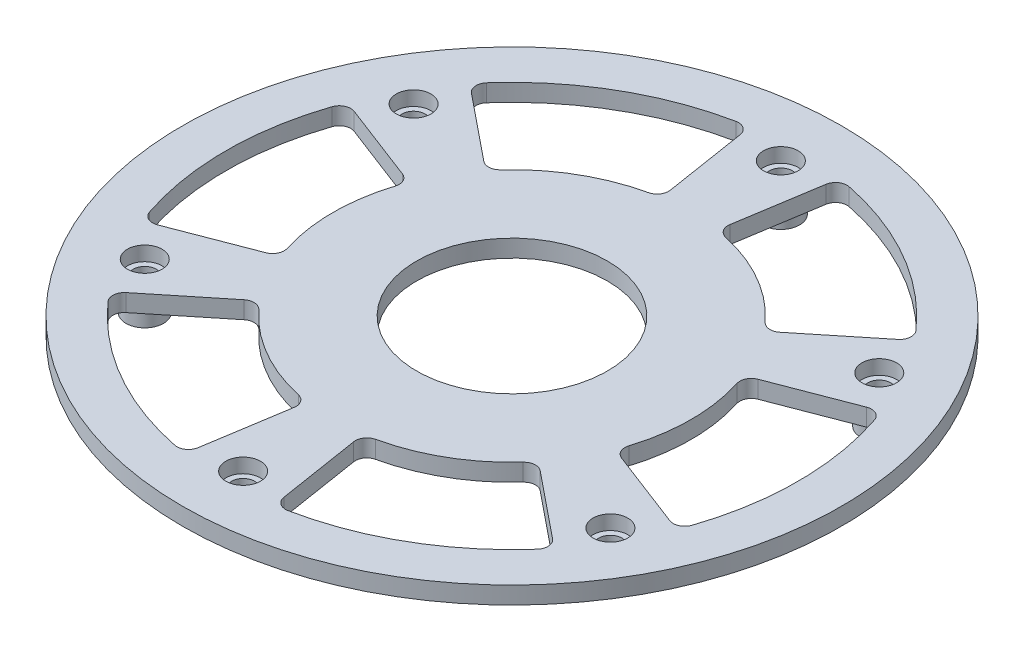
from build123d import *

# Parameters (mm, degrees)
SKETCH1_R                = 57
BOSS_EXTRUDE1_DEPTH      = 3
SKETCH2_R                = 2
CUT_EXTRUDE1_DEPTH       = 81.665977958
CIRPATTERN1_COUNT        = 6
SKETCH5_R                = 3.25
BOSS_EXTRUDE2_DEPTH      = 5
SKETCH4_R                = 16.5
CUT_EXTRUDE3_DEPTH       = 81.765091469
SKETCH8_R                = 2
CUT_EXTRUDE4_DEPTH       = 82.006172604
SKETCH9_R                = 3
CUT_EXTRUDE5_DEPTH       = 2.5
CUT_EXTRUDE6_DEPTH       = 82.006172604
FILLET1_R                = 2
CIRPATTERN2_COUNT        = 6
FILLET1_OF_CIRPATTERN2_R = 2


with BuildPart() as part:
    # Sketch1 → Boss-Extrude1 (new body)
    with BuildSketch(Plane(origin=(0, 0, 0), x_dir=(1, 0, 0), z_dir=(0, 1, 0))):
        with Locations(Location((0, 0, 0), (0, 0, 270))):
            Circle(SKETCH1_R)
    extrude(amount=BOSS_EXTRUDE1_DEPTH)

    # Sketch2 → Cut-Extrude1 (cut, through all)
    with BuildSketch(Plane(origin=(0, 3, 0), x_dir=(1, 0, 0), z_dir=(0, 1, 0))):
        with Locations(Location((0, 46.5, 0), (0, 0, 270))):
            Circle(SKETCH2_R)
    cut_extrude1 = extrude(amount=-CUT_EXTRUDE1_DEPTH, mode=Mode.SUBTRACT)

    # CirPattern1: Cut-Extrude1 ×6 about axis
    cirpattern1_axis = Axis((0, 0, 0), (0, 1, 0))
    for i in range(1, CIRPATTERN1_COUNT):
        add(cut_extrude1.rotate(cirpattern1_axis, i * 360 / CIRPATTERN1_COUNT), mode=Mode.SUBTRACT)

    # Sketch5 → Boss-Extrude2 (add)
    with BuildSketch(Plane.XZ):
        with Locations(Location((0, 46.5, 0), (0, 0, 90))):
            Circle(SKETCH5_R)
        with Locations(Location((40.270181276, 23.25, 0), (0, 0, 90))):
            Circle(SKETCH5_R)
        with Locations(Location((40.270181276, -23.25, 0), (0, 0, 90))):
            Circle(SKETCH5_R)
        with Locations(Location((0, -46.5, 0), (0, 0, 90))):
            Circle(SKETCH5_R)
        with Locations(Location((-40.270181276, -23.25, 0), (0, 0, 90))):
            Circle(SKETCH5_R)
        with Locations(Location((-40.270181276, 23.25, 0), (0, 0, 90))):
            Circle(SKETCH5_R)
    extrude(amount=BOSS_EXTRUDE2_DEPTH)

    # Sketch4 → Cut-Extrude3 (cut, through all)
    with BuildSketch(Plane.XZ):
        with Locations(Location((0, 0, 0), (0, 0, 270))):
            Circle(SKETCH4_R)
    extrude(amount=-CUT_EXTRUDE3_DEPTH, mode=Mode.SUBTRACT)

    # Sketch8 → Cut-Extrude4 (cut, through all)
    with BuildSketch(Plane(origin=(0, 3, 0), x_dir=(1, 0, 0), z_dir=(0, 1, 0))):
        with Locations(Location((-40.270181276, -23.25, 0), (0, 0, 270))):
            Circle(SKETCH8_R)
        with Locations(Location((0, -46.5, 0), (0, 0, 270))):
            Circle(SKETCH8_R)
        with Locations(Location((40.270181276, -23.25, 0), (0, 0, 270))):
            Circle(SKETCH8_R)
        with Locations(Location((40.270181276, 23.25, 0), (0, 0, 270))):
            Circle(SKETCH8_R)
        with Locations(Location((0, 46.5, 0), (0, 0, 270))):
            Circle(SKETCH8_R)
        with Locations(Location((-40.270181276, 23.25, 0), (0, 0, 270))):
            Circle(SKETCH8_R)
    extrude(amount=-CUT_EXTRUDE4_DEPTH, mode=Mode.SUBTRACT)

    # Sketch9 → Cut-Extrude5 (cut)
    with BuildSketch(Plane(origin=(0, 3, 0), x_dir=(1, 0, 0), z_dir=(0, 1, 0))):
        with Locations(Location((-40.270181276, 23.25, 0), (0, 0, 270))):
            Circle(SKETCH9_R)
        with Locations(Location((0, 46.5, 0), (0, 0, 270))):
            Circle(SKETCH9_R)
        with Locations(Location((40.270181276, 23.25, 0), (0, 0, 270))):
            Circle(SKETCH9_R)
        with Locations(Location((40.270181276, -23.25, 0), (0, 0, 270))):
            Circle(SKETCH9_R)
        with Locations(Location((0, -46.5, 0), (0, 0, 270))):
            Circle(SKETCH9_R)
        with Locations(Location((-40.270181276, -23.25, 0), (0, 0, 270))):
            Circle(SKETCH9_R)
    extrude(amount=-CUT_EXTRUDE5_DEPTH, mode=Mode.SUBTRACT)

    # Sketch10 → Cut-Extrude6 (cut, through all)
    with BuildSketch(Plane(origin=(0, 3, 0), x_dir=(1, 0, 0), z_dir=(0, 1, 0))):
        with BuildLine():
            Line((4.849468416, 30.618338558), (7.743506019, 48.890572859))
            ThreePointArc((7.743506019, 48.890572859), (24.75, 42.868257487), (38.468725092, 31.151359357))
            Line((38.468725092, 31.151359357), (24.091524805, 19.508932123))
            ThreePointArc((24.091524805, 19.508932123), (15.5, 26.846787517), (4.849468416, 30.618338558))
        make_face()
    cut_extrude6 = extrude(amount=-CUT_EXTRUDE6_DEPTH, mode=Mode.SUBTRACT)

    # Fillet1
    fillet1_edges = [part.edges().sort_by_distance(p)[0] for p in [
        (24.091524805, 1.5, -19.508932123),
        (4.849468416, 1.5, -30.618338558),
        (7.743506019, 1.5, -48.890572859),
        (38.468725092, 1.5, -31.151359357),
    ]]
    fillet(fillet1_edges, radius=FILLET1_R)

    # CirPattern2: Cut-Extrude6 ×6 about axis
    cirpattern2_axis = Axis((0, 0, 0), (0, 1, 0))
    for i in range(1, CIRPATTERN2_COUNT):
        add(cut_extrude6.rotate(cirpattern2_axis, i * 360 / CIRPATTERN2_COUNT), mode=Mode.SUBTRACT)

    # Fillet1 of CirPattern2
    fillet1_of_cirpattern2_edges = [part.edges().sort_by_distance(p)[0] for p in [
        (-4.849468416, 1.5, -30.618338558),
        (-24.091524805, 1.5, -19.508932123),
        (-38.468725092, 1.5, -31.151359357),
        (-7.743506019, 1.5, -48.890572859),
        (-28.940993221, 1.5, -11.109406436),
        (-28.940993221, 1.5, 11.109406436),
        (-46.212231112, 1.5, 17.739213502),
        (-46.212231112, 1.5, -17.739213502),
        (-24.091524805, 1.5, 19.508932123),
        (-4.849468416, 1.5, 30.618338558),
        (-7.743506019, 1.5, 48.890572859),
        (-38.468725092, 1.5, 31.151359357),
        (4.849468416, 1.5, 30.618338558),
        (24.091524805, 1.5, 19.508932123),
        (38.468725092, 1.5, 31.151359357),
        (7.743506019, 1.5, 48.890572859),
        (28.940993221, 1.5, 11.109406436),
        (28.940993221, 1.5, -11.109406436),
        (46.212231112, 1.5, -17.739213502),
        (46.212231112, 1.5, 17.739213502),
    ]]
    fillet(fillet1_of_cirpattern2_edges, radius=FILLET1_OF_CIRPATTERN2_R)


solid = part.part
